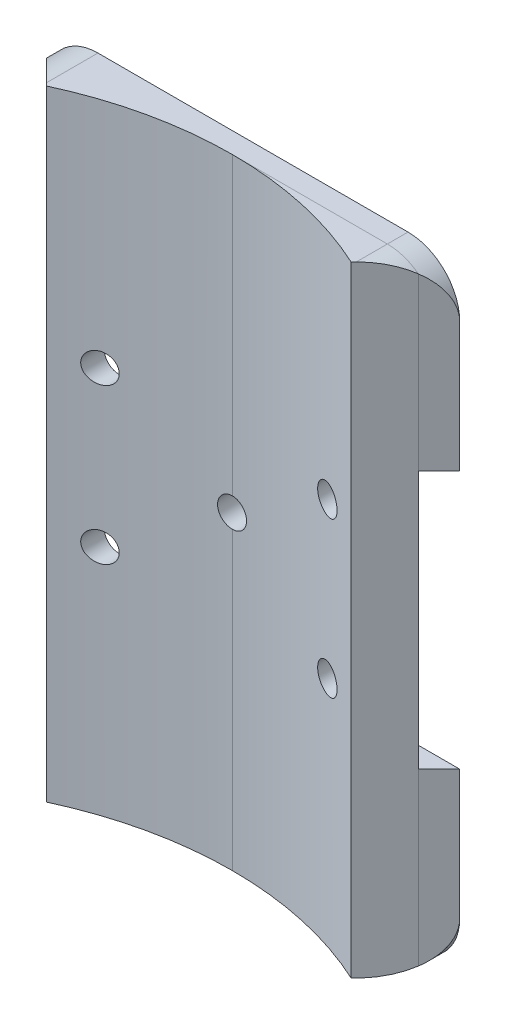
from build123d import *

# Parameters (mm, degrees)
SKETCH1_R           = 1.4
BOSS_EXTRUDE1_DEPTH = 2
BOSS_EXTRUDE5_DEPTH = 60
BOSS_EXTRUDE6_DEPTH = 60
SKETCH11_R          = 1.4
CUT_EXTRUDE2_DEPTH  = 60
CUT_EXTRUDE4_DEPTH  = 35
SKETCH14_W          = 15
SKETCH14_H          = 25
CUT_EXTRUDE5_DEPTH  = 2


with BuildPart() as part:
    # Sketch1 → Boss-Extrude1 (new body)
    with BuildSketch(Plane(origin=(0, 0, -2), x_dir=(-1, 0, 0), z_dir=(0, 0, -1))):
        with BuildLine():
            Line((60.9850693, 26.806434403), (30.9850693, 26.806434403))
            ThreePointArc((30.9850693, 26.806434403), (27.449535394, 25.341968309), (25.9850693, 21.806434403))
            Line((25.9850693, 21.806434403), (25.9850693, -28.193565597))
            ThreePointArc((25.9850693, -28.193565597), (27.449535394, -31.729099503), (30.9850693, -33.193565597))
            Line((30.9850693, -33.193565597), (60.9850693, -33.193565597))
            ThreePointArc((60.9850693, -33.193565597), (64.520603206, -31.729099503), (65.9850693, -28.193565597))
            Line((65.9850693, -28.193565597), (65.9850693, 21.806434403))
            ThreePointArc((65.9850693, 21.806434403), (64.520603206, 25.341968309), (60.9850693, 26.806434403))
        make_face()
        with Locations((34.9850693, 4.306434403)):
            Circle(SKETCH1_R, mode=Mode.SUBTRACT)
        with Locations((34.9850693, -10.693565597)):
            Circle(SKETCH1_R, mode=Mode.SUBTRACT)
        with Locations((56.9850693, 4.306434403)):
            Circle(SKETCH1_R, mode=Mode.SUBTRACT)
        with Locations((56.9850693, -10.693565597)):
            Circle(SKETCH1_R, mode=Mode.SUBTRACT)
        with Locations((45.9850693, -3.193565597)):
            Circle(SKETCH1_R, mode=Mode.SUBTRACT)
    extrude(amount=-BOSS_EXTRUDE1_DEPTH)

    # Sketch8 → Boss-Extrude5 (add)
    with BuildSketch(Plane(origin=(0, 26.806434403, 0), x_dir=(1, 0, 0), z_dir=(0, 1, 0))):
        with BuildLine():
            Line((-65.9850693, 0), (-65.9850693, -6.277186767))
            ThreePointArc((-65.9850693, -6.277186767), (-56.466041031, -1.606149794), (-45.9850693, 0))
            Line((-45.9850693, 0), (-65.9850693, 0))
        make_face()
    extrude(amount=-BOSS_EXTRUDE5_DEPTH)


with BuildPart() as body_2:
    # Sketch9 → Boss-Extrude6 (new body)
    with BuildSketch(Plane(origin=(0, 26.806434403, 0), x_dir=(1, 0, 0), z_dir=(0, 1, 0))):
        with BuildLine():
            Line((-25.9850693, 0), (-25.9850693, -6.277186767))
            ThreePointArc((-25.9850693, -6.277186767), (-35.504097569, -1.606149794), (-45.9850693, 0))
            Line((-45.9850693, 0), (-25.9850693, 0))
        make_face()
    extrude(amount=-BOSS_EXTRUDE6_DEPTH)


with BuildPart() as cut_extrude2_tool:
    # Sketch11 → Cut-Extrude2 (new body)
    with BuildSketch(Plane(origin=(0, 0, -2), x_dir=(-1, 0, 0), z_dir=(0, 0, -1))):
        with Locations((56.9850693, -10.693565597)):
            Circle(SKETCH11_R)
        with Locations((56.9850693, 4.306434403)):
            Circle(SKETCH11_R)
        with Locations((45.9850693, -3.193565597)):
            Circle(SKETCH11_R)
        with Locations((34.9850693, -10.693565597)):
            Circle(SKETCH11_R)
        with Locations((34.9850693, 4.306434403)):
            Circle(SKETCH11_R)
        with BuildLine():
            Line((25.9850693, -33.193565597), (30.9850693, -33.193565597))
            ThreePointArc((30.9850693, -33.193565597), (27.449535394, -31.729099503), (25.9850693, -28.193565597))
            Line((25.9850693, -28.193565597), (25.9850693, -33.193565597))
        make_face()
        with BuildLine():
            Line((60.9850693, -33.193565597), (65.9850693, -33.193565597))
            Line((65.9850693, -33.193565597), (65.9850693, -28.193565597))
            ThreePointArc((65.9850693, -28.193565597), (64.520603206, -31.729099503), (60.9850693, -33.193565597))
        make_face()
        with BuildLine():
            Line((65.9850693, 21.806434403), (65.9850693, 26.806434403))
            Line((65.9850693, 26.806434403), (60.9850693, 26.806434403))
            ThreePointArc((60.9850693, 26.806434403), (64.520603206, 25.341968309), (65.9850693, 21.806434403))
        make_face()
        with BuildLine():
            Line((25.9850693, 21.806434403), (25.9850693, 26.806434403))
            Line((25.9850693, 26.806434403), (30.9850693, 26.806434403))
            ThreePointArc((30.9850693, 26.806434403), (27.449535394, 25.341968309), (25.9850693, 21.806434403))
        make_face()
    extrude(amount=-CUT_EXTRUDE2_DEPTH)


with BuildPart() as part_1:
    add(part.part)

    # Cut-Extrude2: cut by cut_extrude2_tool
    add(cut_extrude2_tool.part, mode=Mode.SUBTRACT)


with BuildPart() as body_2_1:
    add(body_2.part)

    # Cut-Extrude2: cut by cut_extrude2_tool
    add(cut_extrude2_tool.part, mode=Mode.SUBTRACT)


with BuildPart() as cut_extrude4_tool:
    # Sketch13 → Cut-Extrude4 (new, symmetric)
    with BuildSketch(Plane(origin=(0, 0, 0), x_dir=(1, 0, 0), z_dir=(0, 1, 0))):
        with BuildLine():
            Line((-65.9850693, 2), (-60.728347898, -3.256721402))
            ThreePointArc((-60.728347898, -3.256721402), (-63.422232334, -4.652918669), (-65.9850693, -6.277186767))
            Line((-65.9850693, -6.277186767), (-65.9850693, 2))
        make_face()
        with BuildLine():
            Line((-25.9850693, 2), (-25.9850693, -6.277186767))
            ThreePointArc((-25.9850693, -6.277186767), (-28.547906265, -4.652918669), (-31.241790701, -3.256721402))
            Line((-31.241790701, -3.256721402), (-25.9850693, 2))
        make_face()
    extrude(amount=CUT_EXTRUDE4_DEPTH, both=True)


with BuildPart() as part_2:
    add(part_1.part)

    # Cut-Extrude4: cut by cut_extrude4_tool
    add(cut_extrude4_tool.part, mode=Mode.SUBTRACT)

    # Sketch14 → Cut-Extrude5 (cut)
    with BuildSketch(Plane(origin=(0, 0, -2), x_dir=(-1, 0, 0), z_dir=(0, 0, -1))):
        with Locations((33.4850693, -3.193565597)):
            Rectangle(SKETCH14_W, SKETCH14_H)
        with Locations((58.4850693, -3.193565597)):
            Rectangle(SKETCH14_W, SKETCH14_H)
    extrude(amount=-CUT_EXTRUDE5_DEPTH, mode=Mode.SUBTRACT)


with BuildPart() as body_2_2:
    add(body_2_1.part)

    # Cut-Extrude4: cut by cut_extrude4_tool
    add(cut_extrude4_tool.part, mode=Mode.SUBTRACT)


solid = Compound([part_2.part, body_2_2.part])
